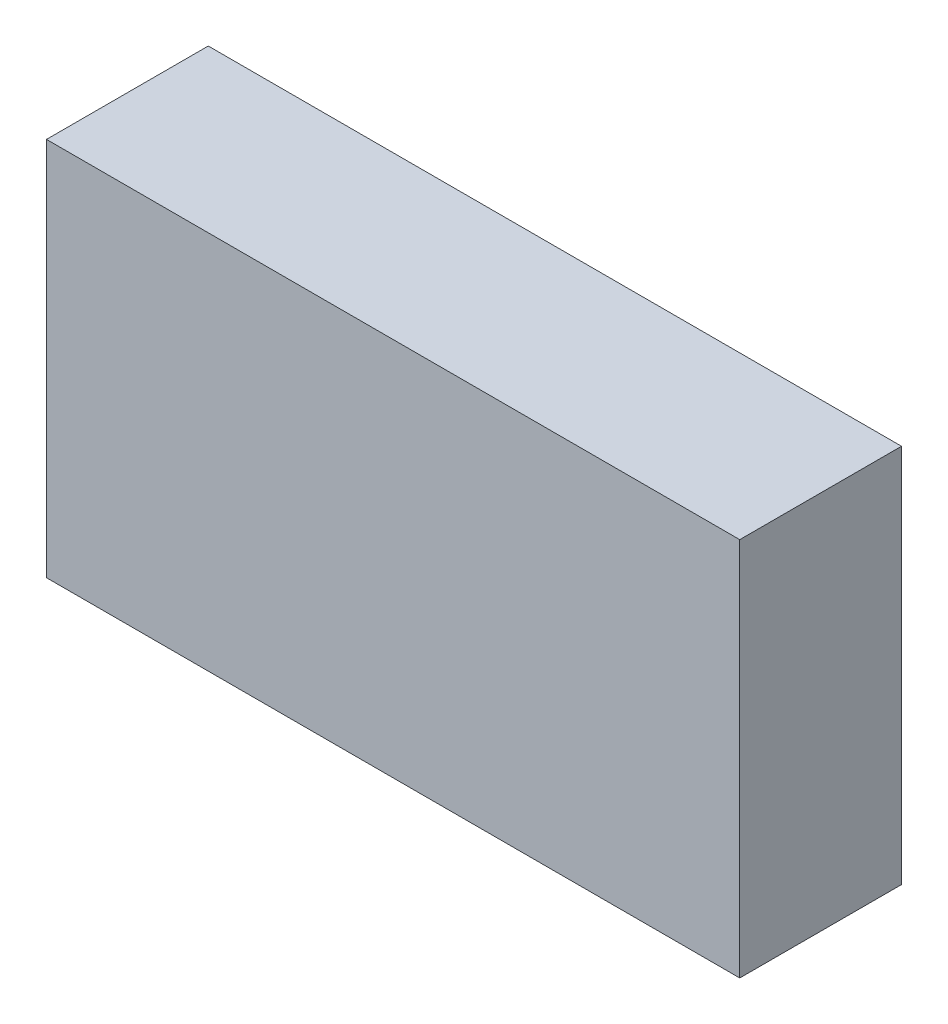
from build123d import *

# Parameters (mm, degrees)
SKETCH_1_W      = 210
SKETCH_1_H      = 115
EXTRUDE_1_DEPTH = 49


with BuildPart() as part:
    # 草图1 → 凸台-拉伸1 (new body)
    with BuildSketch(Plane.XY):
        Rectangle(SKETCH_1_W, SKETCH_1_H)
    extrude(amount=EXTRUDE_1_DEPTH)


solid = part.part
